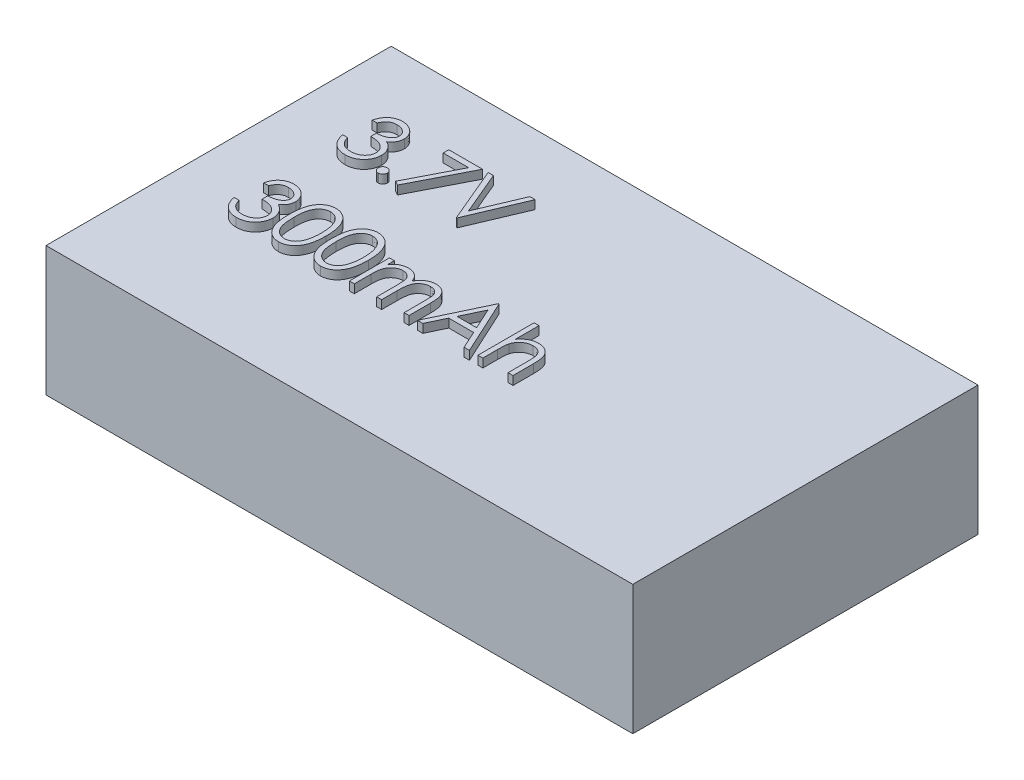
from build123d import *

# Parameters (mm, degrees)
SKETCH1_W           = 34
SKETCH1_H           = 20
BOSS_EXTRUDE1_DEPTH = 7.5
BOSS_EXTRUDE2_DEPTH = 0.5


with BuildPart() as part:
    # Sketch1 → Boss-Extrude1 (new body)
    with BuildSketch(Plane(origin=(0, 0, 0), x_dir=(1, 0, 0), z_dir=(0, 1, 0))):
        Rectangle(SKETCH1_W, SKETCH1_H)
    extrude(amount=BOSS_EXTRUDE1_DEPTH)

    # Sketch2 → Boss-Extrude2 (add)
    # profile 1 of 10: a face of its own
    with BuildSketch(Plane(origin=(0, 7.5, 0), x_dir=(1, 0, 0), z_dir=(0, 1, 0))):
        with BuildLine():
            Line((-13.055505503, 5.241750063), (-13.3404414, 5.241750063))
            add(Edge.make_bspline(
                [(-13.3404414, 5.241750063), (-13.332722022, 5.27371096), (-13.317631269, 5.336191897), (-13.286155613, 5.425461341), (-13.251866289, 5.509937678), (-13.210691887, 5.588039117), (-13.165780374, 5.661335264), (-13.114324762, 5.728163684), (-13.058699014, 5.790224017), (-12.997172096, 5.845299597), (-12.932648238, 5.895172251), (-12.864218262, 5.937694625), (-12.793258923, 5.974274392), (-12.719278581, 6.004409888), (-12.642056982, 6.027111613), (-12.562292252, 6.04358243), (-12.479775363, 6.054278655), (-12.423761477, 6.055322561), (-12.395319204, 6.055852628)],
                knots=[0, 0, 0, 0, 1.162005537, 2.271625781, 3.343758855, 4.383309926, 5.390229558, 6.379919256, 7.361854164, 8.333198761, 9.295911338, 10.242430842, 11.177959212, 12.116337295, 13.062827104, 14.020064771, 14.994644689, 16, 16, 16, 16], degree=3))
            add(Edge.make_bspline(
                [(-12.395319204, 6.055852628), (-12.353878431, 6.054601469), (-12.271900829, 6.052126442), (-12.151465779, 6.029525489), (-12.035327164, 5.993761262), (-11.924756204, 5.94434581), (-11.822050911, 5.883397318), (-11.730668799, 5.810857878), (-11.651848507, 5.728127084), (-11.585722893, 5.636748257), (-11.533947715, 5.539089331), (-11.495769362, 5.43857776), (-11.472526837, 5.335451971), (-11.469514618, 5.265822154), (-11.468005503, 5.230937764)],
                knots=[0, 0, 0, 0, 1.083050992, 2.142477498, 3.193116406, 4.255571735, 5.30263384, 6.308962982, 7.297363603, 8.282367274, 9.249857812, 10.179914175, 11.08814088, 12, 12, 12, 12], degree=3))
            add(Edge.make_bspline(
                [(-11.468005503, 5.230937764), (-11.469061046, 5.197367314), (-11.47112658, 5.131675154), (-11.488665013, 5.035770653), (-11.518180052, 4.945381487), (-11.559064765, 4.860127147), (-11.611988885, 4.780548185), (-11.676099118, 4.706465556), (-11.751847961, 4.637550677), (-11.809250997, 4.598072298), (-11.83880378, 4.57774766)],
                knots=[0, 0, 0, 0, 1.024540389, 2.004866551, 2.965041327, 3.920577974, 4.882998113, 5.874504559, 6.905732034, 8, 8, 8, 8], degree=3))
            add(Edge.make_bspline(
                [(-11.83880378, 4.57774766), (-11.80502926, 4.56143889), (-11.738112166, 4.5291265), (-11.646898472, 4.465757348), (-11.564096399, 4.392590519), (-11.517919454, 4.335492541), (-11.494718243, 4.30680415)],
                knots=[0, 0, 0, 0, 1.015518401, 2.012035669, 3.001164323, 4, 4, 4, 4], degree=3))
            add(Edge.make_bspline(
                [(-11.494718243, 4.30680415), (-11.479440739, 4.285887475), (-11.449135912, 4.244396651), (-11.411729392, 4.177688607), (-11.377793982, 4.110241185), (-11.351350568, 4.040246581), (-11.330872846, 3.968516061), (-11.31623516, 3.894926459), (-11.307141832, 3.819417682), (-11.305839581, 3.768334218), (-11.30518499, 3.742656514)],
                knots=[0, 0, 0, 0, 1.025084078, 2.033381695, 3.024893161, 4.013698104, 4.991890475, 5.976764909, 6.982997093, 8, 8, 8, 8], degree=3))
            add(Edge.make_bspline(
                [(-11.30518499, 3.742656514), (-11.30681287, 3.698197695), (-11.310060969, 3.609489282), (-11.339093237, 3.47843007), (-11.384099534, 3.350318365), (-11.44801404, 3.227786189), (-11.525908137, 3.113141129), (-11.618579424, 3.010564763), (-11.724974952, 2.922391744), (-11.843634362, 2.848722465), (-11.972192042, 2.789832636), (-12.109692758, 2.748959098), (-12.254155307, 2.722338084), (-12.353221927, 2.719483425), (-12.403587434, 2.718032115)],
                knots=[0, 0, 0, 0, 0.955779014, 1.907060117, 2.875433937, 3.871313158, 4.872415639, 5.851225146, 6.836215519, 7.83643374, 8.849228613, 9.86973379, 10.916971861, 12, 12, 12, 12], degree=3))
            add(Edge.make_bspline(
                [(-12.403587434, 2.718032115), (-12.437532085, 2.718819708), (-12.504323838, 2.720369429), (-12.602516155, 2.730963589), (-12.696243696, 2.750312951), (-12.785633189, 2.776350949), (-12.870764043, 2.809363458), (-12.951376481, 2.850473992), (-13.027966456, 2.89883514), (-13.099811219, 2.955017752), (-13.166902206, 3.017865824), (-13.227456463, 3.088495069), (-13.28248356, 3.165599857), (-13.330510097, 3.250075772), (-13.373723618, 3.340831112), (-13.409266343, 3.439027965), (-13.440549681, 3.54378847), (-13.455094323, 3.616793277), (-13.462556785, 3.654250063)],
                knots=[0, 0, 0, 0, 1.048658725, 2.063410685, 3.046034179, 4.001477787, 4.936774919, 5.862367409, 6.792675028, 7.730719943, 8.675894397, 9.627829632, 10.600096036, 11.597688215, 12.626045268, 13.701542398, 14.82072376, 16, 16, 16, 16], degree=3))
            Line((-13.462556785, 3.654250063), (-13.177620887, 3.654250063))
            add(Edge.make_bspline(
                [(-13.177620887, 3.654250063), (-13.170197473, 3.629803459), (-13.155758287, 3.582252689), (-13.131179888, 3.513817554), (-13.103177956, 3.45108132), (-13.07313832, 3.393583774), (-13.041589301, 3.340758666), (-13.006287905, 3.294002827), (-12.969848752, 3.251262608), (-12.942381053, 3.227182853), (-12.928937995, 3.2153979)],
                knots=[0, 0, 0, 0, 1.198163088, 2.33053128, 3.407730985, 4.417276592, 5.372219308, 6.28897303, 7.162600585, 8, 8, 8, 8], degree=3))
            add(Edge.make_bspline(
                [(-12.928937995, 3.2153979), (-12.9111611, 3.201692483), (-12.875662184, 3.174323954), (-12.817815289, 3.139397477), (-12.756977857, 3.109134261), (-12.691831688, 3.086016908), (-12.623782575, 3.066442887), (-12.551730608, 3.053633559), (-12.476311461, 3.044845004), (-12.42481499, 3.044069459), (-12.398499293, 3.04367314)],
                knots=[0, 0, 0, 0, 0.946170439, 1.889420265, 2.845303464, 3.807233317, 4.801018734, 5.828864929, 6.890507805, 8, 8, 8, 8], degree=3))
            add(Edge.make_bspline(
                [(-12.398499293, 3.04367314), (-12.368787187, 3.044231854), (-12.310687728, 3.045324371), (-12.22591082, 3.05537162), (-12.145259064, 3.070004209), (-12.06962791, 3.092603844), (-11.998026664, 3.120526473), (-11.931459025, 3.155586098), (-11.869051129, 3.196720238), (-11.811602311, 3.243473618), (-11.7599446, 3.294655974), (-11.714460899, 3.34818926), (-11.675794242, 3.403847763), (-11.644603425, 3.461939487), (-11.619973997, 3.522223873), (-11.603207093, 3.584870097), (-11.591548933, 3.649365474), (-11.590599506, 3.693206753), (-11.590120887, 3.715307756)],
                knots=[0, 0, 0, 0, 1.217147791, 2.380027433, 3.494444702, 4.572153297, 5.609568379, 6.639424714, 7.649109417, 8.668170816, 9.669597737, 10.625200337, 11.543417969, 12.441394052, 13.322311151, 14.205496177, 15.095365482, 16, 16, 16, 16], degree=3))
            add(Edge.make_bspline(
                [(-11.590120887, 3.715307756), (-11.591509089, 3.744890899), (-11.594278586, 3.803909983), (-11.615422797, 3.890739497), (-11.650201624, 3.974399307), (-11.698890259, 4.05346206), (-11.758159099, 4.126737342), (-11.827432979, 4.192116472), (-11.907287157, 4.246064341), (-11.980783753, 4.283337622), (-12.045885002, 4.308771254), (-12.101597529, 4.325712115), (-12.163969591, 4.34005736), (-12.232246922, 4.353403492), (-12.306943982, 4.364762143), (-12.387979451, 4.374234362), (-12.475369749, 4.381813577), (-12.535868164, 4.385198214), (-12.567043964, 4.386942371)],
                knots=[0, 0, 0, 0, 1.07054697, 2.135767047, 3.216561865, 4.33974944, 5.486079747, 6.621378074, 7.775625952, 8.963672916, 9.598146892, 10.304877434, 11.070270905, 11.915000392, 12.823868403, 13.805723172, 14.86925407, 16, 16, 16, 16], degree=3))
            Line((-12.567043964, 4.386942371), (-12.567043964, 4.712583397))
            add(Edge.make_bspline(
                [(-12.567043964, 4.712583397), (-12.527763621, 4.713249969), (-12.450823078, 4.714555619), (-12.338433244, 4.730347172), (-12.230961025, 4.752191741), (-12.130788195, 4.78565188), (-12.039485434, 4.824514149), (-11.960274081, 4.869737225), (-11.894263883, 4.920006319), (-11.841775625, 4.976097329), (-11.802288396, 5.036254551), (-11.773416944, 5.098953233), (-11.756362362, 5.164742917), (-11.754085736, 5.209641651), (-11.7529414, 5.232209799)],
                knots=[0, 0, 0, 0, 1.321986639, 2.589447074, 3.816329219, 5.01088745, 6.139805852, 7.153945165, 8.075214402, 8.924034688, 9.728124013, 10.488707548, 11.240355623, 12, 12, 12, 12], degree=3))
            add(Edge.make_bspline(
                [(-11.7529414, 5.232209799), (-11.75331733, 5.248790325), (-11.754065225, 5.281776495), (-11.763497041, 5.329968522), (-11.777670278, 5.376687237), (-11.797155461, 5.421733965), (-11.823235999, 5.464796285), (-11.854447143, 5.506241328), (-11.891611063, 5.54583247), (-11.93419729, 5.582735331), (-11.979927999, 5.617904568), (-12.030047438, 5.647761938), (-12.083044424, 5.67329353), (-12.138977632, 5.694347865), (-12.198028578, 5.710185933), (-12.259919812, 5.721557732), (-12.324769354, 5.728667605), (-12.369012282, 5.729691239), (-12.391503099, 5.730211602)],
                knots=[0, 0, 0, 0, 0.884392785, 1.759457502, 2.611959086, 3.489218968, 4.37281399, 5.2945488, 6.255912374, 7.266815255, 8.301784654, 9.332968512, 10.37626691, 11.440494194, 12.520033166, 13.637162961, 14.798855837, 16, 16, 16, 16], degree=3))
            add(Edge.make_bspline(
                [(-12.391503099, 5.730211602), (-12.427654255, 5.728949438), (-12.49826587, 5.726484138), (-12.600060831, 5.704891404), (-12.694693369, 5.670439857), (-12.767027731, 5.629316332), (-12.820442638, 5.588721296), (-12.858612432, 5.553267988), (-12.896096038, 5.513868212), (-12.930427473, 5.468095258), (-12.965147438, 5.419048955), (-12.996756433, 5.364236044), (-13.027472011, 5.305086343), (-13.045980038, 5.263271018), (-13.055505503, 5.241750063)],
                knots=[0, 0, 0, 0, 1.472543308, 2.876219568, 4.221790263, 5.565193594, 6.249813518, 6.953379497, 7.687249741, 8.463570142, 9.283606569, 10.136032583, 11.040678096, 12, 12, 12, 12], degree=3))
        make_face()
    # profile 2 of 10: a face of its own
    with BuildSketch(Plane(origin=(0, 7.5, 0), x_dir=(1, 0, 0), z_dir=(0, 1, 0))):
        with BuildLine():
            add(Edge.make_bspline(
                [(-10.51143499, 3.28790391), (-10.493754583, 3.286853287), (-10.459094213, 3.284793664), (-10.408984432, 3.270663396), (-10.363632133, 3.245573039), (-10.323235026, 3.212133233), (-10.289937008, 3.171587882), (-10.263952488, 3.126597307), (-10.249945309, 3.076068006), (-10.247900689, 3.0412068), (-10.246851656, 3.023320576)],
                knots=[0, 0, 0, 0, 1.020151414, 1.999887582, 2.974338812, 3.990962822, 5.007586832, 5.987933904, 6.967670073, 8, 8, 8, 8], degree=3))
            add(Edge.make_bspline(
                [(-10.246851656, 3.023320576), (-10.247936237, 3.005864127), (-10.250075014, 2.971440266), (-10.26392038, 2.921292082), (-10.29013504, 2.87627339), (-10.323005355, 2.835177879), (-10.36364212, 2.801667232), (-10.409091652, 2.776790341), (-10.458976579, 2.76164833), (-10.493734958, 2.759719475), (-10.51143499, 2.758737243)],
                knots=[0, 0, 0, 0, 1.009421747, 1.99056486, 2.972319754, 3.999869655, 5.017953583, 5.993804169, 6.978383603, 8, 8, 8, 8], degree=3))
            add(Edge.make_bspline(
                [(-10.51143499, 2.758737243), (-10.529147776, 2.759683935), (-10.563727773, 2.761532125), (-10.613426497, 2.777101242), (-10.659152818, 2.801433952), (-10.699781671, 2.835240363), (-10.732927284, 2.876061922), (-10.757987453, 2.921602123), (-10.773037088, 2.971296712), (-10.775016359, 3.005835853), (-10.776018323, 3.023320576)],
                knots=[0, 0, 0, 0, 1.022052826, 1.995314843, 2.982371812, 4.00089066, 5.028879526, 6.005146991, 6.990147033, 8, 8, 8, 8], degree=3))
            add(Edge.make_bspline(
                [(-10.776018323, 3.023320576), (-10.775054847, 3.041236085), (-10.773173779, 3.076213917), (-10.757955859, 3.126287393), (-10.733121724, 3.171797334), (-10.699552544, 3.212071375), (-10.659162647, 3.245805571), (-10.613536804, 3.270357205), (-10.563608078, 3.28490815), (-10.529127634, 3.286888004), (-10.51143499, 3.28790391)],
                knots=[0, 0, 0, 0, 1.032775665, 2.016367738, 2.991239715, 4.008302682, 5.025365648, 6.011011707, 6.979408107, 8, 8, 8, 8], degree=3))
        make_face()
    # profile 3 of 10: a face of its own
    with BuildSketch(Plane(origin=(0, 7.5, 0), x_dir=(1, 0, 0), z_dir=(0, 1, 0))):
        Polygon((-9.636274733, 5.974442371), (-7.682428579, 5.974442371), (-9.351338836, 2.718032115), (-9.597477658, 2.853503869), (-8.164529942, 5.648801345), (-9.636274733, 5.648801345), align=None)
    # profile 4 of 10: a face of its own
    with BuildSketch(Plane(origin=(0, 7.5, 0), x_dir=(1, 0, 0), z_dir=(0, 1, 0))):
        Polygon((-7.356787554, 5.974442371), (-7.051499092, 5.974442371), (-5.993165759, 3.472349022), (-4.934832426, 5.974442371), (-4.629543964, 5.974442371), (-5.972813195, 2.799442371), (-6.013518323, 2.799442371), align=None)
    # profile 5 of 10: a face of its own
    with BuildSketch(Plane(origin=(0, 7.5, 0), x_dir=(1, 0, 0), z_dir=(0, 1, 0))):
        with BuildLine():
            Line((-13.055505503, -1.049916603), (-13.3404414, -1.049916603))
            add(Edge.make_bspline(
                [(-13.3404414, -1.049916603), (-13.332722022, -1.017955707), (-13.317631269, -0.955474769), (-13.286155613, -0.866205325), (-13.251866289, -0.781728988), (-13.210691887, -0.70362755), (-13.165780374, -0.630331402), (-13.114324762, -0.563502982), (-13.058699014, -0.501442649), (-12.997172096, -0.44636707), (-12.932648238, -0.396494415), (-12.864218262, -0.353972042), (-12.793258923, -0.317392275), (-12.719278581, -0.287256779), (-12.642056982, -0.264555054), (-12.562292252, -0.248084237), (-12.479775363, -0.237388012), (-12.423761477, -0.236344105), (-12.395319204, -0.235814039)],
                knots=[0, 0, 0, 0, 1.162005537, 2.271625781, 3.343758855, 4.383309926, 5.390229558, 6.379919256, 7.361854164, 8.333198761, 9.295911338, 10.242430842, 11.177959212, 12.116337295, 13.062827104, 14.020064771, 14.994644689, 16, 16, 16, 16], degree=3))
            add(Edge.make_bspline(
                [(-12.395319204, -0.235814039), (-12.353878431, -0.237065198), (-12.271900829, -0.239540224), (-12.151465779, -0.262141177), (-12.035327164, -0.297905405), (-11.924756204, -0.347320857), (-11.822050911, -0.408269348), (-11.730668799, -0.480808788), (-11.651848507, -0.563539583), (-11.585722893, -0.654918409), (-11.533947715, -0.752577336), (-11.495769362, -0.853088907), (-11.472526837, -0.956214695), (-11.469514618, -1.025844513), (-11.468005503, -1.060728903)],
                knots=[0, 0, 0, 0, 1.083050992, 2.142477498, 3.193116406, 4.255571735, 5.30263384, 6.308962982, 7.297363603, 8.282367274, 9.249857812, 10.179914175, 11.08814088, 12, 12, 12, 12], degree=3))
            add(Edge.make_bspline(
                [(-11.468005503, -1.060728903), (-11.469061046, -1.094299352), (-11.47112658, -1.159991513), (-11.488665013, -1.255896014), (-11.518180052, -1.346285179), (-11.559064765, -1.431539519), (-11.611988885, -1.511118481), (-11.676099118, -1.585201111), (-11.751847961, -1.65411599), (-11.809250997, -1.693594369), (-11.83880378, -1.713919007)],
                knots=[0, 0, 0, 0, 1.024540389, 2.004866551, 2.965041327, 3.920577974, 4.882998113, 5.874504559, 6.905732034, 8, 8, 8, 8], degree=3))
            add(Edge.make_bspline(
                [(-11.83880378, -1.713919007), (-11.80502926, -1.730227777), (-11.738112166, -1.762540167), (-11.646898472, -1.825909319), (-11.564096399, -1.899076148), (-11.517919454, -1.956174126), (-11.494718243, -1.984862517)],
                knots=[0, 0, 0, 0, 1.015518401, 2.012035669, 3.001164323, 4, 4, 4, 4], degree=3))
            add(Edge.make_bspline(
                [(-11.494718243, -1.984862517), (-11.479440739, -2.005779191), (-11.449135912, -2.047270016), (-11.411729392, -2.113978059), (-11.377793982, -2.181425482), (-11.351350568, -2.251420086), (-11.330872846, -2.323150605), (-11.31623516, -2.396740207), (-11.307141832, -2.472248985), (-11.305839581, -2.523332449), (-11.30518499, -2.549010153)],
                knots=[0, 0, 0, 0, 1.025084078, 2.033381695, 3.024893161, 4.013698104, 4.991890475, 5.976764909, 6.982997093, 8, 8, 8, 8], degree=3))
            add(Edge.make_bspline(
                [(-11.30518499, -2.549010153), (-11.30681287, -2.593468971), (-11.310060969, -2.682177385), (-11.339093237, -2.813236596), (-11.384099534, -2.941348302), (-11.44801404, -3.063880478), (-11.525908137, -3.178525537), (-11.618579424, -3.281101904), (-11.724974952, -3.369274923), (-11.843634362, -3.442944201), (-11.972192042, -3.501834031), (-12.109692758, -3.542707568), (-12.254155307, -3.569328582), (-12.353221927, -3.572183242), (-12.403587434, -3.573634552)],
                knots=[0, 0, 0, 0, 0.955779014, 1.907060117, 2.875433937, 3.871313158, 4.872415639, 5.851225146, 6.836215519, 7.83643374, 8.849228613, 9.86973379, 10.916971861, 12, 12, 12, 12], degree=3))
            add(Edge.make_bspline(
                [(-12.403587434, -3.573634552), (-12.437532085, -3.572846959), (-12.504323838, -3.571297237), (-12.602516155, -3.560703078), (-12.696243696, -3.541353716), (-12.785633189, -3.515315717), (-12.870764043, -3.482303208), (-12.951376481, -3.441192675), (-13.027966456, -3.392831527), (-13.099811219, -3.336648915), (-13.166902206, -3.273800843), (-13.227456463, -3.203171598), (-13.28248356, -3.12606681), (-13.330510097, -3.041590895), (-13.373723618, -2.950835554), (-13.409266343, -2.852638702), (-13.440549681, -2.747878196), (-13.455094323, -2.674873389), (-13.462556785, -2.637416603)],
                knots=[0, 0, 0, 0, 1.048658725, 2.063410685, 3.046034179, 4.001477787, 4.936774919, 5.862367409, 6.792675028, 7.730719943, 8.675894397, 9.627829632, 10.600096036, 11.597688215, 12.626045268, 13.701542398, 14.82072376, 16, 16, 16, 16], degree=3))
            Line((-13.462556785, -2.637416603), (-13.177620887, -2.637416603))
            add(Edge.make_bspline(
                [(-13.177620887, -2.637416603), (-13.170197473, -2.661863208), (-13.155758287, -2.709413978), (-13.131179888, -2.777849113), (-13.103177956, -2.840585347), (-13.07313832, -2.898082893), (-13.041589301, -2.950908001), (-13.006287905, -2.997663839), (-12.969848752, -3.040404058), (-12.942381053, -3.064483813), (-12.928937995, -3.076268767)],
                knots=[0, 0, 0, 0, 1.198163088, 2.33053128, 3.407730985, 4.417276592, 5.372219308, 6.28897303, 7.162600585, 8, 8, 8, 8], degree=3))
            add(Edge.make_bspline(
                [(-12.928937995, -3.076268767), (-12.9111611, -3.089974184), (-12.875662184, -3.117342713), (-12.817815289, -3.15226919), (-12.756977857, -3.182532406), (-12.691831688, -3.205649758), (-12.623782575, -3.225223779), (-12.551730608, -3.238033107), (-12.476311461, -3.246821663), (-12.42481499, -3.247597208), (-12.398499293, -3.247993526)],
                knots=[0, 0, 0, 0, 0.946170439, 1.889420265, 2.845303464, 3.807233317, 4.801018734, 5.828864929, 6.890507805, 8, 8, 8, 8], degree=3))
            add(Edge.make_bspline(
                [(-12.398499293, -3.247993526), (-12.368787187, -3.247434812), (-12.310687728, -3.246342295), (-12.22591082, -3.236295047), (-12.145259064, -3.221662458), (-12.06962791, -3.199062823), (-11.998026664, -3.171140194), (-11.931459025, -3.136080569), (-11.869051129, -3.094946428), (-11.811602311, -3.048193049), (-11.7599446, -2.997010692), (-11.714460899, -2.943477406), (-11.675794242, -2.887818904), (-11.644603425, -2.82972718), (-11.619973997, -2.769442794), (-11.603207093, -2.70679657), (-11.591548933, -2.642301193), (-11.590599506, -2.598459914), (-11.590120887, -2.576358911)],
                knots=[0, 0, 0, 0, 1.217147791, 2.380027433, 3.494444702, 4.572153297, 5.609568379, 6.639424714, 7.649109417, 8.668170816, 9.669597737, 10.625200337, 11.543417969, 12.441394052, 13.322311151, 14.205496177, 15.095365482, 16, 16, 16, 16], degree=3))
            add(Edge.make_bspline(
                [(-11.590120887, -2.576358911), (-11.591509089, -2.546775768), (-11.594278586, -2.487756683), (-11.615422797, -2.400927169), (-11.650201624, -2.31726736), (-11.698890259, -2.238204607), (-11.758159099, -2.164929325), (-11.827432979, -2.099550194), (-11.907287157, -2.045602326), (-11.980783753, -2.008329045), (-12.045885002, -1.982895413), (-12.101597529, -1.965954552), (-12.163969591, -1.951609307), (-12.232246922, -1.938263175), (-12.306943982, -1.926904524), (-12.387979451, -1.917432305), (-12.475369749, -1.909853089), (-12.535868164, -1.906468453), (-12.567043964, -1.904724296)],
                knots=[0, 0, 0, 0, 1.07054697, 2.135767047, 3.216561865, 4.33974944, 5.486079747, 6.621378074, 7.775625952, 8.963672916, 9.598146892, 10.304877434, 11.070270905, 11.915000392, 12.823868403, 13.805723172, 14.86925407, 16, 16, 16, 16], degree=3))
            Line((-12.567043964, -1.904724296), (-12.567043964, -1.57908327))
            add(Edge.make_bspline(
                [(-12.567043964, -1.57908327), (-12.527763621, -1.578416698), (-12.450823078, -1.577111047), (-12.338433244, -1.561319495), (-12.230961025, -1.539474925), (-12.130788195, -1.506014787), (-12.039485434, -1.467152517), (-11.960274081, -1.421929441), (-11.894263883, -1.371660348), (-11.841775625, -1.315569338), (-11.802288396, -1.255412116), (-11.773416944, -1.192713434), (-11.756362362, -1.12692375), (-11.754085736, -1.082025015), (-11.7529414, -1.059456868)],
                knots=[0, 0, 0, 0, 1.321986639, 2.589447074, 3.816329219, 5.01088745, 6.139805852, 7.153945165, 8.075214402, 8.924034688, 9.728124013, 10.488707548, 11.240355623, 12, 12, 12, 12], degree=3))
            add(Edge.make_bspline(
                [(-11.7529414, -1.059456868), (-11.75331733, -1.042876342), (-11.754065225, -1.009890172), (-11.763497041, -0.961698145), (-11.777670278, -0.91497943), (-11.797155461, -0.869932702), (-11.823235999, -0.826870382), (-11.854447143, -0.785425339), (-11.891611063, -0.745834197), (-11.93419729, -0.708931335), (-11.979927999, -0.673762099), (-12.030047438, -0.643904728), (-12.083044424, -0.618373136), (-12.138977632, -0.597318802), (-12.198028578, -0.581480734), (-12.259919812, -0.570108935), (-12.324769354, -0.562999062), (-12.369012282, -0.561975428), (-12.391503099, -0.561455065)],
                knots=[0, 0, 0, 0, 0.884392785, 1.759457502, 2.611959086, 3.489218968, 4.37281399, 5.2945488, 6.255912374, 7.266815255, 8.301784654, 9.332968512, 10.37626691, 11.440494194, 12.520033166, 13.637162961, 14.798855837, 16, 16, 16, 16], degree=3))
            add(Edge.make_bspline(
                [(-12.391503099, -0.561455065), (-12.427654255, -0.562717229), (-12.49826587, -0.565182529), (-12.600060831, -0.586775263), (-12.694693369, -0.62122681), (-12.767027731, -0.662350335), (-12.820442638, -0.702945371), (-12.858612432, -0.738398679), (-12.896096038, -0.777798454), (-12.930427473, -0.823571409), (-12.965147438, -0.872617712), (-12.996756433, -0.927430623), (-13.027472011, -0.986580323), (-13.045980038, -1.028395649), (-13.055505503, -1.049916603)],
                knots=[0, 0, 0, 0, 1.472543308, 2.876219568, 4.221790263, 5.565193594, 6.249813518, 6.953379497, 7.687249741, 8.463570142, 9.283606569, 10.136032583, 11.040678096, 12, 12, 12, 12], degree=3))
        make_face()
    # profile 6 of 10: a face of its own
    with BuildSketch(Plane(origin=(0, 7.5, 0), x_dir=(1, 0, 0), z_dir=(0, 1, 0))):
        with BuildLine():
            add(Edge.make_bspline(
                [(-11.020249092, -1.905996331), (-11.019951533, -1.855107986), (-11.01937352, -1.756256643), (-11.012943309, -1.61221629), (-11.002261392, -1.477088027), (-10.987622489, -1.350865389), (-10.969808036, -1.233515788), (-10.946026844, -1.12535283), (-10.918982373, -1.025875901), (-10.887638369, -0.934760614), (-10.852270874, -0.850779412), (-10.813776938, -0.772379408), (-10.770628874, -0.699679227), (-10.725292675, -0.631518517), (-10.675933153, -0.569013022), (-10.623954964, -0.511280036), (-10.567329405, -0.459653855), (-10.50798139, -0.412621852), (-10.445373598, -0.371392688), (-10.381290608, -0.335077275), (-10.315291333, -0.30405311), (-10.247195581, -0.279659643), (-10.177615404, -0.259511232), (-10.106307565, -0.245732687), (-10.033154328, -0.237063206), (-9.98377724, -0.236234379), (-9.958735671, -0.235814039)],
                knots=[0, 0, 0, 0, 1.646270934, 3.197905019, 4.663502075, 6.030701355, 7.308322542, 8.50163776, 9.611534131, 10.641858119, 11.616356847, 12.558055219, 13.465016945, 14.349605745, 15.204443733, 16.039544428, 16.859896111, 17.680448484, 18.487036065, 19.28249412, 20.06191084, 20.843045899, 21.620316918, 22.403196591, 23.190181807, 24, 24, 24, 24], degree=3))
            add(Edge.make_bspline(
                [(-9.958735671, -0.235814039), (-9.933484915, -0.236256557), (-9.883269107, -0.237136586), (-9.809028195, -0.245594734), (-9.736502413, -0.259629253), (-9.666000958, -0.279514709), (-9.596944721, -0.304185072), (-9.529873837, -0.335106957), (-9.464371698, -0.371101358), (-9.401479223, -0.413395876), (-9.340505965, -0.460551226), (-9.282949598, -0.513857361), (-9.228804885, -0.572776035), (-9.177392286, -0.636676869), (-9.130170423, -0.706785482), (-9.085200238, -0.781882496), (-9.044948463, -0.863281209), (-9.006182007, -0.94962349), (-8.972720241, -1.043298381), (-8.942543004, -1.143777842), (-8.91815994, -1.252248711), (-8.897849671, -1.368141877), (-8.882115373, -1.491882951), (-8.870655762, -1.62320668), (-8.86460232, -1.762199463), (-8.863462313, -1.857229798), (-8.862877297, -1.905996331)],
                knots=[0, 0, 0, 0, 0.810914788, 1.612654377, 2.396697861, 3.181598691, 3.963628158, 4.749916497, 5.551656086, 6.361998678, 7.18212741, 8.025565596, 8.878627764, 9.750805457, 10.657531673, 11.591944965, 12.560506719, 13.57287815, 14.630710178, 15.753379473, 16.941251878, 18.199788006, 19.531962791, 20.947069417, 22.433333509, 24, 24, 24, 24], degree=3))
            add(Edge.make_bspline(
                [(-8.862877297, -1.905996331), (-8.863468378, -1.954550162), (-8.864620073, -2.049155321), (-8.8705879, -2.187522706), (-8.88234323, -2.318149502), (-8.897048005, -2.441348993), (-8.917414236, -2.556608404), (-8.942456065, -2.664326583), (-8.970260287, -2.764968705), (-9.00458185, -2.857710284), (-9.04214728, -2.943845061), (-9.083018779, -3.024278831), (-9.126806407, -3.09972254), (-9.174511912, -3.16957231), (-9.225360365, -3.234322949), (-9.280440074, -3.292831507), (-9.33819839, -3.346507759), (-9.399351081, -3.394270307), (-9.463224417, -3.436075808), (-9.52850158, -3.473462658), (-9.596340792, -3.50360946), (-9.665204685, -3.529494819), (-9.736078274, -3.549270943), (-9.808873214, -3.562945083), (-9.883219228, -3.57253526), (-9.933476362, -3.573266853), (-9.958735671, -3.573634552)],
                knots=[0, 0, 0, 0, 1.561518951, 3.042555995, 4.452378317, 5.7783523, 7.031515105, 8.214008947, 9.334062868, 10.386615937, 11.391082383, 12.354592575, 13.286541444, 14.194233754, 15.072674879, 15.931287219, 16.775624067, 17.606195743, 18.42308326, 19.229000347, 20.022332153, 20.807536673, 21.593273796, 22.3848459, 23.188221202, 24, 24, 24, 24], degree=3))
            add(Edge.make_bspline(
                [(-9.958735671, -3.573634552), (-9.983776546, -3.573211501), (-10.033152263, -3.572377327), (-10.106315535, -3.563747013), (-10.177328894, -3.549871807), (-10.246542764, -3.530443887), (-10.314312245, -3.506663286), (-10.379713877, -3.475681016), (-10.443474847, -3.439999396), (-10.505425044, -3.39936355), (-10.564400362, -3.352807451), (-10.620732668, -3.301314132), (-10.673006793, -3.243598609), (-10.721660579, -3.180572207), (-10.767901359, -3.112814766), (-10.810436719, -3.039401171), (-10.84978028, -2.960622517), (-10.885742589, -2.875969841), (-10.917627448, -2.78420787), (-10.945792155, -2.68428683), (-10.968029998, -2.575324789), (-10.987064536, -2.458196891), (-11.002417369, -2.332399826), (-11.012898793, -2.197865299), (-11.019376986, -2.054677145), (-11.019953085, -1.956460992), (-11.020249092, -1.905996331)],
                knots=[0, 0, 0, 0, 0.810891512, 1.598919785, 2.382837074, 3.152667961, 3.926044502, 4.706494248, 5.493654104, 6.291793342, 7.103789334, 7.925228297, 8.761435821, 9.622817696, 10.50288917, 11.416980706, 12.369136599, 13.353924996, 14.394355917, 15.514179734, 16.714354668, 17.994756427, 19.357759367, 20.818452758, 22.365282078, 24, 24, 24, 24], degree=3))
        make_face()
        with BuildLine():
            add(Edge.make_bspline(
                [(-10.735313195, -1.904724296), (-10.735204839, -1.947132044), (-10.734994542, -2.029437156), (-10.729500703, -2.149037828), (-10.722016564, -2.260589484), (-10.712363388, -2.364233763), (-10.698027856, -2.459619846), (-10.68196527, -2.547403773), (-10.662418074, -2.627120981), (-10.639290451, -2.699318495), (-10.612947841, -2.765221578), (-10.584186094, -2.826545538), (-10.553288152, -2.884014794), (-10.518708637, -2.937113139), (-10.481048544, -2.986013731), (-10.441158516, -3.031582086), (-10.397549815, -3.072219347), (-10.33722142, -3.12095728), (-10.257577475, -3.171321066), (-10.157228919, -3.215177876), (-10.054115396, -3.242739104), (-9.98412819, -3.246244083), (-9.949195406, -3.247993526)],
                knots=[0, 0, 0, 0, 1.459021318, 2.831673884, 4.118529203, 5.306027144, 6.411944654, 7.436330062, 8.375795394, 9.233974572, 10.042671642, 10.816086306, 11.563610507, 12.285937304, 12.993564865, 13.685989202, 14.367179055, 15.041617293, 16.353048772, 17.594441528, 18.799311195, 20, 20, 20, 20], degree=3))
            add(Edge.make_bspline(
                [(-9.949195406, -3.247993526), (-9.914036661, -3.246544111), (-9.843791761, -3.243648272), (-9.741163247, -3.215709418), (-9.641531502, -3.173554907), (-9.563451956, -3.12370967), (-9.504049934, -3.0762404), (-9.461489522, -3.03576854), (-9.422426092, -2.990451432), (-9.385376496, -2.941557071), (-9.351395763, -2.888151317), (-9.320495631, -2.830490981), (-9.292298594, -2.768415941), (-9.27623396, -2.725081963), (-9.268020527, -2.702926419)],
                knots=[0, 0, 0, 0, 1.353760809, 2.704726607, 4.075137775, 5.516104923, 6.260822281, 7.007110065, 7.778089737, 8.566572457, 9.372053459, 10.217411131, 11.088608312, 12, 12, 12, 12], degree=3))
            add(Edge.make_bspline(
                [(-9.268020527, -2.702926419), (-9.258448566, -2.674596584), (-9.23901338, -2.617074869), (-9.213965557, -2.527844985), (-9.194239373, -2.434225335), (-9.176492606, -2.336775407), (-9.164379476, -2.234776536), (-9.154629674, -2.128544316), (-9.148886837, -2.017998652), (-9.148174955, -1.942891767), (-9.147813195, -1.904724296)],
                knots=[0, 0, 0, 0, 0.884706709, 1.796334032, 2.740027952, 3.714592787, 4.726048262, 5.777819803, 6.87074269, 8, 8, 8, 8], degree=3))
            add(Edge.make_bspline(
                [(-9.147813195, -1.904724296), (-9.148312295, -1.866562998), (-9.149288642, -1.791911341), (-9.153020616, -1.682584134), (-9.162657716, -1.578745523), (-9.173361202, -1.479948165), (-9.189142967, -1.386738962), (-9.206158978, -1.298337614), (-9.229020078, -1.215839298), (-9.253440159, -1.137952392), (-9.281389589, -1.065561798), (-9.312156005, -0.998330006), (-9.345014315, -0.935932435), (-9.380703348, -0.878540281), (-9.418799432, -0.825896474), (-9.460308065, -0.77905652), (-9.503582747, -0.736568699), (-9.564195479, -0.688070511), (-9.643547157, -0.638620616), (-9.742285708, -0.593113105), (-9.845038364, -0.566979869), (-9.914501426, -0.563295338), (-9.949195406, -0.561455065)],
                knots=[0, 0, 0, 0, 1.31362396, 2.569729283, 3.763502607, 4.902122613, 5.988968491, 7.01645872, 7.998833611, 8.933434873, 9.825090667, 10.667526885, 11.477055099, 12.250526234, 12.991942729, 13.710640831, 14.402115721, 15.076753259, 16.378508321, 17.609869233, 18.806226677, 20, 20, 20, 20], degree=3))
            add(Edge.make_bspline(
                [(-9.949195406, -0.561455065), (-9.984311443, -0.563297877), (-10.054607491, -0.566986859), (-10.158428135, -0.593015739), (-10.257945654, -0.638384644), (-10.337087496, -0.688234296), (-10.397742502, -0.735712621), (-10.440453231, -0.776884619), (-10.480500116, -0.821920864), (-10.517391529, -0.871271172), (-10.551943951, -0.924307613), (-10.583676726, -0.981447421), (-10.612267447, -1.042980158), (-10.638651276, -1.108853639), (-10.661849448, -1.181044924), (-10.680984686, -1.26066394), (-10.698662227, -1.348168656), (-10.711176507, -1.444071353), (-10.722301485, -1.547741592), (-10.729450994, -1.65957173), (-10.73501292, -1.77937299), (-10.735211099, -1.862103655), (-10.735313195, -1.904724296)],
                knots=[0, 0, 0, 0, 1.207732386, 2.417664972, 3.655092373, 4.956220595, 5.625982001, 6.301752483, 6.994047911, 7.697131622, 8.419323945, 9.170223765, 9.943494443, 10.752040957, 11.610060368, 12.549350801, 13.567764191, 14.679664412, 15.874934091, 17.154273443, 18.533957287, 20, 20, 20, 20], degree=3))
        make_face(mode=Mode.SUBTRACT)
    # profile 7 of 10: a face of its own
    with BuildSketch(Plane(origin=(0, 7.5, 0), x_dir=(1, 0, 0), z_dir=(0, 1, 0))):
        with BuildLine():
            add(Edge.make_bspline(
                [(-8.5779414, -1.905996331), (-8.577643841, -1.855107986), (-8.577065827, -1.756256643), (-8.570635617, -1.61221629), (-8.559953699, -1.477088027), (-8.545314797, -1.350865389), (-8.527500343, -1.233515788), (-8.503719152, -1.12535283), (-8.476674681, -1.025875901), (-8.445330676, -0.934760614), (-8.409963182, -0.850779412), (-8.371469246, -0.772379408), (-8.328321182, -0.699679227), (-8.282984983, -0.631518517), (-8.23362546, -0.569013022), (-8.181647272, -0.511280036), (-8.125021713, -0.459653855), (-8.065673698, -0.412621852), (-8.003065905, -0.371392688), (-7.938982915, -0.335077275), (-7.872983641, -0.30405311), (-7.804887889, -0.279659643), (-7.735307712, -0.259511232), (-7.663999873, -0.245732687), (-7.590846635, -0.237063206), (-7.541469548, -0.236234379), (-7.516427978, -0.235814039)],
                knots=[0, 0, 0, 0, 1.646270934, 3.197905019, 4.663502075, 6.030701355, 7.308322542, 8.50163776, 9.611534131, 10.641858119, 11.616356847, 12.558055219, 13.465016945, 14.349605745, 15.204443733, 16.039544428, 16.859896111, 17.680448484, 18.487036065, 19.28249412, 20.06191084, 20.843045899, 21.620316918, 22.403196591, 23.190181807, 24, 24, 24, 24], degree=3))
            add(Edge.make_bspline(
                [(-7.516427978, -0.235814039), (-7.491177223, -0.236256557), (-7.440961415, -0.237136586), (-7.366720503, -0.245594734), (-7.29419472, -0.259629253), (-7.223693266, -0.279514709), (-7.154637028, -0.304185072), (-7.087566144, -0.335106957), (-7.022064006, -0.371101358), (-6.959171531, -0.413395876), (-6.898198273, -0.460551226), (-6.840641906, -0.513857361), (-6.786497193, -0.572776035), (-6.735084594, -0.636676869), (-6.687862731, -0.706785482), (-6.642892546, -0.781882496), (-6.60264077, -0.863281209), (-6.563874315, -0.94962349), (-6.530412549, -1.043298381), (-6.500235312, -1.143777842), (-6.475852247, -1.252248711), (-6.455541979, -1.368141877), (-6.439807681, -1.491882951), (-6.42834807, -1.62320668), (-6.422294628, -1.762199463), (-6.421154621, -1.857229798), (-6.420569605, -1.905996331)],
                knots=[0, 0, 0, 0, 0.810914788, 1.612654377, 2.396697861, 3.181598691, 3.963628158, 4.749916497, 5.551656086, 6.361998678, 7.18212741, 8.025565596, 8.878627764, 9.750805457, 10.657531673, 11.591944965, 12.560506719, 13.57287815, 14.630710178, 15.753379473, 16.941251878, 18.199788006, 19.531962791, 20.947069417, 22.433333509, 24, 24, 24, 24], degree=3))
            add(Edge.make_bspline(
                [(-6.420569605, -1.905996331), (-6.421160685, -1.954550162), (-6.422312381, -2.049155321), (-6.428280208, -2.187522706), (-6.440035538, -2.318149502), (-6.454740313, -2.441348993), (-6.475106544, -2.556608404), (-6.500148373, -2.664326583), (-6.527952594, -2.764968705), (-6.562274158, -2.857710284), (-6.599839588, -2.943845061), (-6.640711087, -3.024278831), (-6.684498715, -3.09972254), (-6.732204219, -3.16957231), (-6.783052673, -3.234322949), (-6.838132381, -3.292831507), (-6.895890698, -3.346507759), (-6.957043389, -3.394270307), (-7.020916725, -3.436075808), (-7.086193888, -3.473462658), (-7.1540331, -3.50360946), (-7.222896992, -3.529494819), (-7.293770582, -3.549270943), (-7.366565522, -3.562945083), (-7.440911536, -3.57253526), (-7.49116867, -3.573266853), (-7.516427978, -3.573634552)],
                knots=[0, 0, 0, 0, 1.561518951, 3.042555995, 4.452378317, 5.7783523, 7.031515105, 8.214008947, 9.334062868, 10.386615937, 11.391082383, 12.354592575, 13.286541444, 14.194233754, 15.072674879, 15.931287219, 16.775624067, 17.606195743, 18.42308326, 19.229000347, 20.022332153, 20.807536673, 21.593273796, 22.3848459, 23.188221202, 24, 24, 24, 24], degree=3))
            add(Edge.make_bspline(
                [(-7.516427978, -3.573634552), (-7.541468853, -3.573211501), (-7.590844571, -3.572377327), (-7.664007842, -3.563747013), (-7.735021202, -3.549871807), (-7.804235072, -3.530443887), (-7.872004553, -3.506663286), (-7.937406185, -3.475681016), (-8.001167155, -3.439999396), (-8.063117352, -3.39936355), (-8.12209267, -3.352807451), (-8.178424976, -3.301314132), (-8.2306991, -3.243598609), (-8.279352887, -3.180572207), (-8.325593667, -3.112814766), (-8.368129027, -3.039401171), (-8.407472588, -2.960622517), (-8.443434897, -2.875969841), (-8.475319756, -2.78420787), (-8.503484463, -2.68428683), (-8.525722306, -2.575324789), (-8.544756844, -2.458196891), (-8.560109677, -2.332399826), (-8.5705911, -2.197865299), (-8.577069293, -2.054677145), (-8.577645393, -1.956460992), (-8.5779414, -1.905996331)],
                knots=[0, 0, 0, 0, 0.810891512, 1.598919785, 2.382837074, 3.152667961, 3.926044502, 4.706494248, 5.493654104, 6.291793342, 7.103789334, 7.925228297, 8.761435821, 9.622817696, 10.50288917, 11.416980706, 12.369136599, 13.353924996, 14.394355917, 15.514179734, 16.714354668, 17.994756427, 19.357759367, 20.818452758, 22.365282078, 24, 24, 24, 24], degree=3))
        make_face()
        with BuildLine():
            add(Edge.make_bspline(
                [(-8.293005503, -1.904724296), (-8.292897147, -1.947132044), (-8.29268685, -2.029437156), (-8.287193011, -2.149037828), (-8.279708872, -2.260589484), (-8.270055695, -2.364233763), (-8.255720163, -2.459619846), (-8.239657577, -2.547403773), (-8.220110382, -2.627120981), (-8.196982758, -2.699318495), (-8.170640149, -2.765221578), (-8.141878401, -2.826545538), (-8.11098046, -2.884014794), (-8.076400945, -2.937113139), (-8.038740852, -2.986013731), (-7.998850824, -3.031582086), (-7.955242122, -3.072219347), (-7.894913727, -3.12095728), (-7.815269783, -3.171321066), (-7.714921227, -3.215177876), (-7.611807703, -3.242739104), (-7.541820498, -3.246244083), (-7.506887714, -3.247993526)],
                knots=[0, 0, 0, 0, 1.459021318, 2.831673884, 4.118529203, 5.306027144, 6.411944654, 7.436330062, 8.375795394, 9.233974572, 10.042671642, 10.816086306, 11.563610507, 12.285937304, 12.993564865, 13.685989202, 14.367179055, 15.041617293, 16.353048772, 17.594441528, 18.799311195, 20, 20, 20, 20], degree=3))
            add(Edge.make_bspline(
                [(-7.506887714, -3.247993526), (-7.471728969, -3.246544111), (-7.401484069, -3.243648272), (-7.298855555, -3.215709418), (-7.19922381, -3.173554907), (-7.121144264, -3.12370967), (-7.061742242, -3.0762404), (-7.01918183, -3.03576854), (-6.9801184, -2.990451432), (-6.943068804, -2.941557071), (-6.909088071, -2.888151317), (-6.878187939, -2.830490981), (-6.849990902, -2.768415941), (-6.833926267, -2.725081963), (-6.825712834, -2.702926419)],
                knots=[0, 0, 0, 0, 1.353760809, 2.704726607, 4.075137775, 5.516104923, 6.260822281, 7.007110065, 7.778089737, 8.566572457, 9.372053459, 10.217411131, 11.088608312, 12, 12, 12, 12], degree=3))
            add(Edge.make_bspline(
                [(-6.825712834, -2.702926419), (-6.816140873, -2.674596584), (-6.796705688, -2.617074869), (-6.771657864, -2.527844985), (-6.751931681, -2.434225335), (-6.734184913, -2.336775407), (-6.722071784, -2.234776536), (-6.712321982, -2.128544316), (-6.706579144, -2.017998652), (-6.705867263, -1.942891767), (-6.705505503, -1.904724296)],
                knots=[0, 0, 0, 0, 0.884706709, 1.796334032, 2.740027952, 3.714592787, 4.726048262, 5.777819803, 6.87074269, 8, 8, 8, 8], degree=3))
            add(Edge.make_bspline(
                [(-6.705505503, -1.904724296), (-6.706004603, -1.866562998), (-6.70698095, -1.791911341), (-6.710712924, -1.682584134), (-6.720350024, -1.578745523), (-6.73105351, -1.479948165), (-6.746835275, -1.386738962), (-6.763851286, -1.298337614), (-6.786712385, -1.215839298), (-6.811132467, -1.137952392), (-6.839081897, -1.065561798), (-6.869848313, -0.998330006), (-6.902706623, -0.935932435), (-6.938395655, -0.878540281), (-6.976491739, -0.825896474), (-7.018000373, -0.77905652), (-7.061275054, -0.736568699), (-7.121887787, -0.688070511), (-7.201239464, -0.638620616), (-7.299978016, -0.593113105), (-7.402730672, -0.566979869), (-7.472193734, -0.563295338), (-7.506887714, -0.561455065)],
                knots=[0, 0, 0, 0, 1.31362396, 2.569729283, 3.763502607, 4.902122613, 5.988968491, 7.01645872, 7.998833611, 8.933434873, 9.825090667, 10.667526885, 11.477055099, 12.250526234, 12.991942729, 13.710640831, 14.402115721, 15.076753259, 16.378508321, 17.609869233, 18.806226677, 20, 20, 20, 20], degree=3))
            add(Edge.make_bspline(
                [(-7.506887714, -0.561455065), (-7.542003751, -0.563297877), (-7.612299798, -0.566986859), (-7.716120443, -0.593015739), (-7.815637962, -0.638384644), (-7.894779803, -0.688234296), (-7.95543481, -0.735712621), (-7.998145539, -0.776884619), (-8.038192423, -0.821920864), (-8.075083837, -0.871271172), (-8.109636258, -0.924307613), (-8.141369034, -0.981447421), (-8.169959755, -1.042980158), (-8.196343584, -1.108853639), (-8.219541756, -1.181044924), (-8.238676994, -1.26066394), (-8.256354535, -1.348168656), (-8.268868815, -1.444071353), (-8.279993793, -1.547741592), (-8.287143301, -1.65957173), (-8.292705228, -1.77937299), (-8.292903406, -1.862103655), (-8.293005503, -1.904724296)],
                knots=[0, 0, 0, 0, 1.207732386, 2.417664972, 3.655092373, 4.956220595, 5.625982001, 6.301752483, 6.994047911, 7.697131622, 8.419323945, 9.170223765, 9.943494443, 10.752040957, 11.610060368, 12.549350801, 13.567764191, 14.679664412, 15.874934091, 17.154273443, 18.533957287, 20, 20, 20, 20], degree=3))
        make_face(mode=Mode.SUBTRACT)
    # profile 8 of 10: a face of its own
    with BuildSketch(Plane(origin=(0, 7.5, 0), x_dir=(1, 0, 0), z_dir=(0, 1, 0))):
        with BuildLine():
            Line((-5.932108067, -1.172031988), (-5.647172169, -1.172031988))
            Line((-5.647172169, -1.172031988), (-5.647172169, -1.575267164))
            add(Edge.make_bspline(
                [(-5.647172169, -1.575267164), (-5.621514586, -1.539990554), (-5.572352197, -1.472397187), (-5.491738355, -1.383324572), (-5.411205739, -1.307734032), (-5.353209028, -1.268052998), (-5.325347249, -1.248990121)],
                knots=[0, 0, 0, 0, 1.134379233, 2.173579362, 3.122582517, 4, 4, 4, 4], degree=3))
            add(Edge.make_bspline(
                [(-5.325347249, -1.248990121), (-5.28737002, -1.230842397), (-5.212079068, -1.19486401), (-5.092863057, -1.158366425), (-4.970875321, -1.135937226), (-4.888499298, -1.132869837), (-4.847061993, -1.13132686)],
                knots=[0, 0, 0, 0, 1.014936303, 2.012140481, 3.000054389, 4, 4, 4, 4], degree=3))
            add(Edge.make_bspline(
                [(-4.847061993, -1.13132686), (-4.819037632, -1.132275088), (-4.763578928, -1.13415158), (-4.681406218, -1.146361755), (-4.601705905, -1.167467498), (-4.524948893, -1.19686557), (-4.452630848, -1.232467922), (-4.386328505, -1.274241585), (-4.326797973, -1.321138218), (-4.274069341, -1.375275536), (-4.226653868, -1.438173736), (-4.183039485, -1.511529162), (-4.142739471, -1.596988968), (-4.120404427, -1.659007188), (-4.108645527, -1.69165839)],
                knots=[0, 0, 0, 0, 1.009824226, 1.998387844, 2.986035974, 3.974953746, 4.955485308, 5.885931332, 6.793869504, 7.679848016, 8.601185859, 9.625726857, 10.749998409, 12, 12, 12, 12], degree=3))
            add(Edge.make_bspline(
                [(-4.108645527, -1.69165839), (-4.096207463, -1.66922981), (-4.0717311, -1.625093513), (-4.030632415, -1.562629233), (-3.987572343, -1.504203072), (-3.94218391, -1.449768672), (-3.89462732, -1.399594845), (-3.844678764, -1.353515706), (-3.79262257, -1.311333369), (-3.720239609, -1.262054503), (-3.626066744, -1.209711289), (-3.507332525, -1.164328343), (-3.38382487, -1.136282998), (-3.299988815, -1.132989822), (-3.25765394, -1.13132686)],
                knots=[0, 0, 0, 0, 0.86119277, 1.694706429, 2.50939023, 3.298075842, 4.073795165, 4.829715201, 5.57930267, 6.321991688, 7.768977793, 9.186738141, 10.579381044, 12, 12, 12, 12], degree=3))
            add(Edge.make_bspline(
                [(-3.25765394, -1.13132686), (-3.218754327, -1.13279391), (-3.142624008, -1.13566507), (-3.031791774, -1.158210721), (-2.92843028, -1.196925444), (-2.832747503, -1.249751671), (-2.746423958, -1.316135644), (-2.671388449, -1.395119519), (-2.608096763, -1.486144612), (-2.566750425, -1.571771631), (-2.538705864, -1.647368683), (-2.521414602, -1.711781533), (-2.506138592, -1.782676156), (-2.493455606, -1.860137321), (-2.484185919, -1.944438659), (-2.477318199, -2.035442211), (-2.472669932, -2.133218705), (-2.472341481, -2.200678837), (-2.472172169, -2.235453462)],
                knots=[0, 0, 0, 0, 1.209669288, 2.367440248, 3.500751976, 4.631527125, 5.755587489, 6.87532382, 8.007944318, 9.190864318, 9.82315674, 10.514484317, 11.263564316, 12.079023757, 12.955305781, 13.901327259, 14.918167583, 16, 16, 16, 16], degree=3))
            Line((-2.472172169, -2.235453462), (-2.472172169, -3.492224296))
            Line((-2.472172169, -3.492224296), (-2.757108067, -3.492224296))
            Line((-2.757108067, -3.492224296), (-2.757108067, -2.234181427))
            add(Edge.make_bspline(
                [(-2.757108067, -2.234181427), (-2.757178718, -2.204499192), (-2.757314498, -2.147454451), (-2.759758007, -2.065582584), (-2.764362042, -1.990953432), (-2.769745607, -1.923668752), (-2.77722392, -1.863571636), (-2.7868813, -1.8107828), (-2.797111767, -1.764886985), (-2.814107988, -1.714008927), (-2.841275004, -1.657883808), (-2.882656575, -1.597355993), (-2.934790171, -1.54466841), (-2.994988313, -1.498931794), (-3.063521545, -1.461744705), (-3.139054544, -1.435187182), (-3.221118362, -1.418747142), (-3.277926178, -1.417108828), (-3.307263315, -1.416262757)],
                knots=[0, 0, 0, 0, 1.253487763, 2.409012846, 3.458416907, 4.410876679, 5.259312806, 6.014470957, 6.676830364, 7.243083969, 8.276244668, 9.299465089, 10.325150304, 11.392391894, 12.482080715, 13.603491619, 14.762376348, 16, 16, 16, 16], degree=3))
            add(Edge.make_bspline(
                [(-3.307263315, -1.416262757), (-3.343249631, -1.417547414), (-3.414372272, -1.420086385), (-3.518190677, -1.44600697), (-3.617950099, -1.485086911), (-3.710673827, -1.541722069), (-3.795970466, -1.609583942), (-3.86935794, -1.690273932), (-3.92998428, -1.781559652), (-3.971036101, -1.866057017), (-3.996970681, -1.941957156), (-4.01409474, -2.008266915), (-4.027414674, -2.083633765), (-4.039906511, -2.167551275), (-4.048059664, -2.260597081), (-4.055469545, -2.362340774), (-4.058935613, -2.473088366), (-4.059420444, -2.549856862), (-4.059672169, -2.589715281)],
                knots=[0, 0, 0, 0, 1.090531906, 2.155305635, 3.229839962, 4.33261226, 5.44038871, 6.529323825, 7.629011124, 8.757537029, 9.370236727, 10.061839251, 10.834451254, 11.692844982, 12.636905849, 13.66920014, 14.789842145, 16, 16, 16, 16], degree=3))
            Line((-4.059672169, -2.589715281), (-4.059672169, -3.492224296))
            Line((-4.059672169, -3.492224296), (-4.344608067, -3.492224296))
            Line((-4.344608067, -3.492224296), (-4.344608067, -2.312411595))
            add(Edge.make_bspline(
                [(-4.344608067, -2.312411595), (-4.344680122, -2.279125513), (-4.344818749, -2.215086437), (-4.347246551, -2.123253032), (-4.351860844, -2.039722338), (-4.357195341, -1.964591438), (-4.364869932, -1.897996876), (-4.373587359, -1.839581631), (-4.38388217, -1.78949215), (-4.400927279, -1.734552508), (-4.426975404, -1.674027099), (-4.468874756, -1.60949203), (-4.521133061, -1.55300597), (-4.582429498, -1.504783391), (-4.65137751, -1.46492219), (-4.727562452, -1.436202272), (-4.810298337, -1.41948881), (-4.867337399, -1.417358388), (-4.896671368, -1.416262757)],
                knots=[0, 0, 0, 0, 1.320475261, 2.540461679, 3.643808994, 4.639130445, 5.527981419, 6.302341397, 6.981980563, 7.553956391, 8.582137848, 9.585246428, 10.591171744, 11.620968678, 12.668337649, 13.738356861, 14.836885341, 16, 16, 16, 16], degree=3))
            add(Edge.make_bspline(
                [(-4.896671368, -1.416262757), (-4.931157503, -1.417651103), (-4.999887144, -1.420418027), (-5.100853931, -1.445322975), (-5.198358801, -1.484333815), (-5.290846278, -1.538453793), (-5.375822113, -1.605490815), (-5.450215326, -1.684335042), (-5.512756046, -1.774005236), (-5.554241335, -1.857611619), (-5.581000665, -1.931610233), (-5.598776433, -1.99452145), (-5.61405238, -2.064371675), (-5.625404385, -2.141376411), (-5.636363048, -2.225034118), (-5.641651971, -2.315761548), (-5.646796888, -2.41348087), (-5.647044007, -2.480947394), (-5.647172169, -2.515937236)],
                knots=[0, 0, 0, 0, 1.098833095, 2.189935336, 3.297829714, 4.440610912, 5.596351641, 6.740013378, 7.886572111, 9.072425424, 9.705826452, 10.395263256, 11.156850408, 11.985370555, 12.878090359, 13.847760091, 14.883794034, 16, 16, 16, 16], degree=3))
            Line((-5.647172169, -2.515937236), (-5.647172169, -3.492224296))
            Line((-5.647172169, -3.492224296), (-5.932108067, -3.492224296))
            Line((-5.932108067, -3.492224296), (-5.932108067, -1.172031988))
        make_face()
    # profile 9 of 10: a face of its own
    with BuildSketch(Plane(origin=(0, 7.5, 0), x_dir=(1, 0, 0), z_dir=(0, 1, 0))):
        Polygon((-0.436915759, -0.317224296), (1.028468856, -3.492224296), (0.718728272, -3.492224296), (0.249347262, -2.47459609), (-1.189960631, -2.47459609), (-1.672698011, -3.492224296), (-1.983710631, -3.492224296), (-0.477620887, -0.317224296), align=None)
        Polygon((-0.460448411, -0.936069448), (-1.035408347, -2.148955065), (0.099247102, -2.148955065), align=None, mode=Mode.SUBTRACT)
    # profile 10 of 10: a face of its own
    with BuildSketch(Plane(origin=(0, 7.5, 0), x_dir=(1, 0, 0), z_dir=(0, 1, 0))):
        with BuildLine():
            Line((1.516930395, -0.235814039), (1.801866292, -0.235814039))
            Line((1.801866292, -0.235814039), (1.801866292, -1.610248134))
            add(Edge.make_bspline(
                [(1.801866292, -1.610248134), (1.832452702, -1.572017521), (1.892006008, -1.49758056), (1.992241771, -1.400460766), (2.095176062, -1.316279159), (2.20436414, -1.249268102), (2.317802826, -1.19633038), (2.43597056, -1.158785872), (2.558889299, -1.135698092), (2.642369256, -1.13279667), (2.68465876, -1.13132686)],
                knots=[0, 0, 0, 0, 1.125788106, 2.19196713, 3.20547328, 4.180437432, 5.132270164, 6.079753143, 7.027236121, 8, 8, 8, 8], degree=3))
            add(Edge.make_bspline(
                [(2.68465876, -1.13132686), (2.727594188, -1.132910214), (2.811629177, -1.136009221), (2.933985932, -1.160514217), (3.04825044, -1.202385607), (3.154083026, -1.259687123), (3.249174001, -1.331054616), (3.333402002, -1.413451783), (3.402200441, -1.508950266), (3.449008211, -1.597175582), (3.479464088, -1.675678594), (3.498742531, -1.743021716), (3.515088518, -1.818062309), (3.529330421, -1.900761745), (3.538822384, -1.991517007), (3.546446573, -2.089918652), (3.551868071, -2.195961038), (3.55207817, -2.269367264), (3.552186805, -2.307323454)],
                knots=[0, 0, 0, 0, 1.235656852, 2.418478516, 3.575258207, 4.727955599, 5.870717718, 6.98870536, 8.107142894, 9.245821548, 9.854588956, 10.528768408, 11.260415777, 12.065282286, 12.943670737, 13.886611085, 14.907229059, 16, 16, 16, 16], degree=3))
            Line((3.552186805, -2.307323454), (3.552186805, -3.492224296))
            Line((3.552186805, -3.492224296), (3.267250908, -3.492224296))
            Line((3.267250908, -3.492224296), (3.267250908, -2.400818046))
            add(Edge.make_bspline(
                [(3.267250908, -2.400818046), (3.267078276, -2.36922891), (3.26674806, -2.308804269), (3.265656454, -2.222293585), (3.263219673, -2.143829234), (3.259281924, -2.073662685), (3.255140538, -2.011696116), (3.249440672, -1.958019517), (3.242809245, -1.912559164), (3.236850422, -1.885195536), (3.234177991, -1.872923414)],
                knots=[0, 0, 0, 0, 1.430932559, 2.737130458, 3.918967929, 4.986496826, 5.920444988, 6.731744033, 7.431208747, 8, 8, 8, 8], degree=3))
            add(Edge.make_bspline(
                [(3.234177991, -1.872923414), (3.223814569, -1.836915046), (3.20389095, -1.767689169), (3.157583142, -1.673652554), (3.09974461, -1.593474968), (3.029126023, -1.528238435), (2.94697665, -1.47706511), (2.852760825, -1.441625051), (2.747365277, -1.419628903), (2.6731143, -1.417416106), (2.634413368, -1.416262757)],
                knots=[0, 0, 0, 0, 1.090059168, 2.095632401, 3.037101401, 3.955032261, 4.878929692, 5.839099886, 6.873700383, 8, 8, 8, 8], degree=3))
            add(Edge.make_bspline(
                [(2.634413368, -1.416262757), (2.611491888, -1.4166944), (2.566130871, -1.417548609), (2.498867439, -1.426124645), (2.433617502, -1.44013884), (2.36975267, -1.459102243), (2.308626483, -1.484906408), (2.248457217, -1.514778794), (2.190949613, -1.55134414), (2.135082479, -1.592370372), (2.083087288, -1.637790797), (2.034711976, -1.685730534), (1.991587911, -1.736779966), (1.952518546, -1.790120072), (1.91879253, -1.846482484), (1.889352948, -1.905323687), (1.864374138, -1.966721062), (1.851961981, -2.009334154), (1.845751509, -2.030655786)],
                knots=[0, 0, 0, 0, 1.024319606, 2.027102035, 3.025350316, 4.005802111, 5.00026367, 5.987881639, 7.005602596, 8.042517216, 9.083927026, 10.089214625, 11.084353441, 12.06828073, 13.041928858, 14.016821737, 15.00770877, 16, 16, 16, 16], degree=3))
            add(Edge.make_bspline(
                [(1.845751509, -2.030655786), (1.842177885, -2.04609622), (1.83439052, -2.079742826), (1.825940636, -2.135236677), (1.818377063, -2.199722172), (1.811983022, -2.273101502), (1.808061365, -2.355643558), (1.803835675, -2.44678507), (1.802262677, -2.547096946), (1.802002369, -2.616852157), (1.801866292, -2.653317044)],
                knots=[0, 0, 0, 0, 0.607992626, 1.324890765, 2.152360218, 3.099583803, 4.150613268, 5.323148443, 6.60066238, 8, 8, 8, 8], degree=3))
            Line((1.801866292, -2.653317044), (1.801866292, -3.492224296))
            Line((1.801866292, -3.492224296), (1.516930395, -3.492224296))
            Line((1.516930395, -3.492224296), (1.516930395, -0.235814039))
        make_face()
    extrude(amount=BOSS_EXTRUDE2_DEPTH)


solid = part.part
